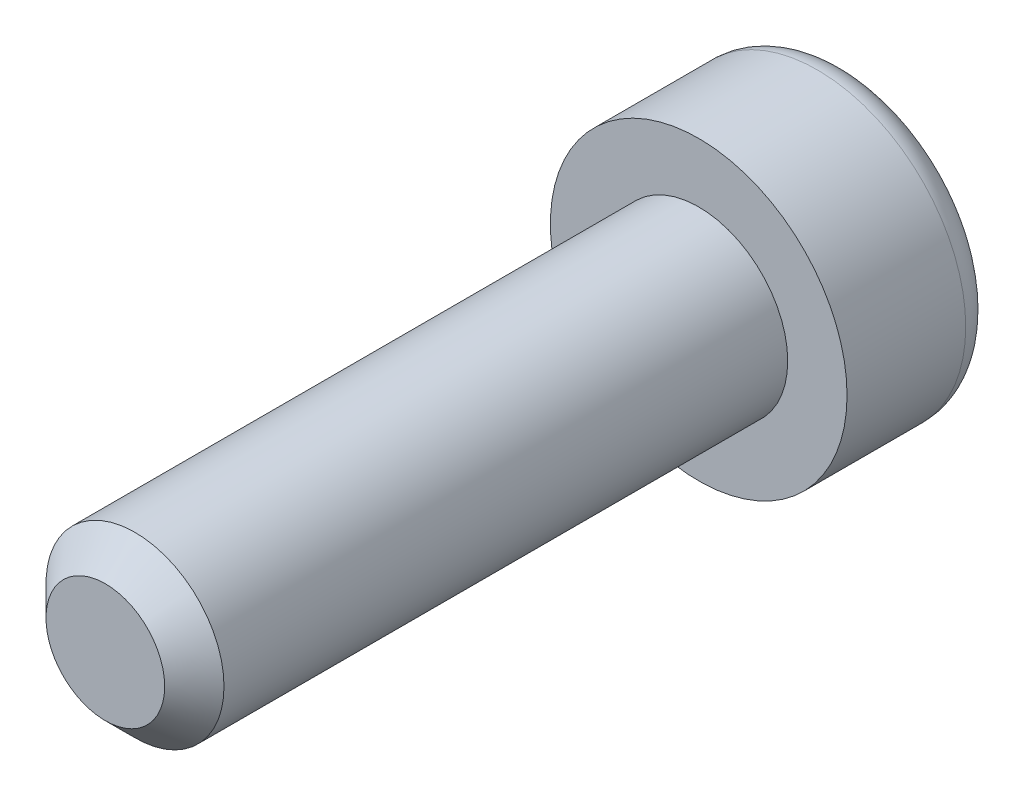
from build123d import *

# Parameters (mm, degrees)
ESQUISSE1_R             = 2.5
BASE_EXTRUSION_DEPTH    = 2.5
ESQUISSE2_R             = 1.5
BOSS_EXTRU_1_DEPTH      = 10
ENL_V_MAT_EXTRU_1_DEPTH = 2
CONG_1_R                = 0.5
CHANFREIN1_SIZE         = 0.5


with BuildPart() as part:
    # Esquisse1 → Base-Extrusion (new body)
    with BuildSketch(Plane.XY):
        Circle(ESQUISSE1_R)
    extrude(amount=BASE_EXTRUSION_DEPTH)

    # Esquisse2 → Boss.-Extru.1 (add)
    with BuildSketch(Plane.XY.offset(2.5)):
        Circle(ESQUISSE2_R)
    extrude(amount=BOSS_EXTRU_1_DEPTH)

    # Esquisse3 → Enlèv. mat.-Extru.1 (cut)
    with BuildSketch(Plane(origin=(0, 0, 0), x_dir=(-1, 0, 0), z_dir=(0, 0, -1))):
        Polygon((0, 1.45), (-1.25, 0.728312164), (-1.25, -0.715063509), (0, -1.436751346), (1.25, -0.715063509), (1.25, 0.728312164), align=None)
    extrude(amount=-ENL_V_MAT_EXTRU_1_DEPTH, mode=Mode.SUBTRACT)

    # Congé1
    cong_1_edges = [part.edges().sort_by_distance(p)[0] for p in [
        (-2.5, 0, 0),
    ]]
    fillet(cong_1_edges, radius=CONG_1_R)

    # Chanfrein1
    chanfrein1_edges = [part.edges().sort_by_distance(p)[0] for p in [
        (-1.5, 0, 12.5),
    ]]
    chamfer(chanfrein1_edges, length=CHANFREIN1_SIZE)


solid = part.part
